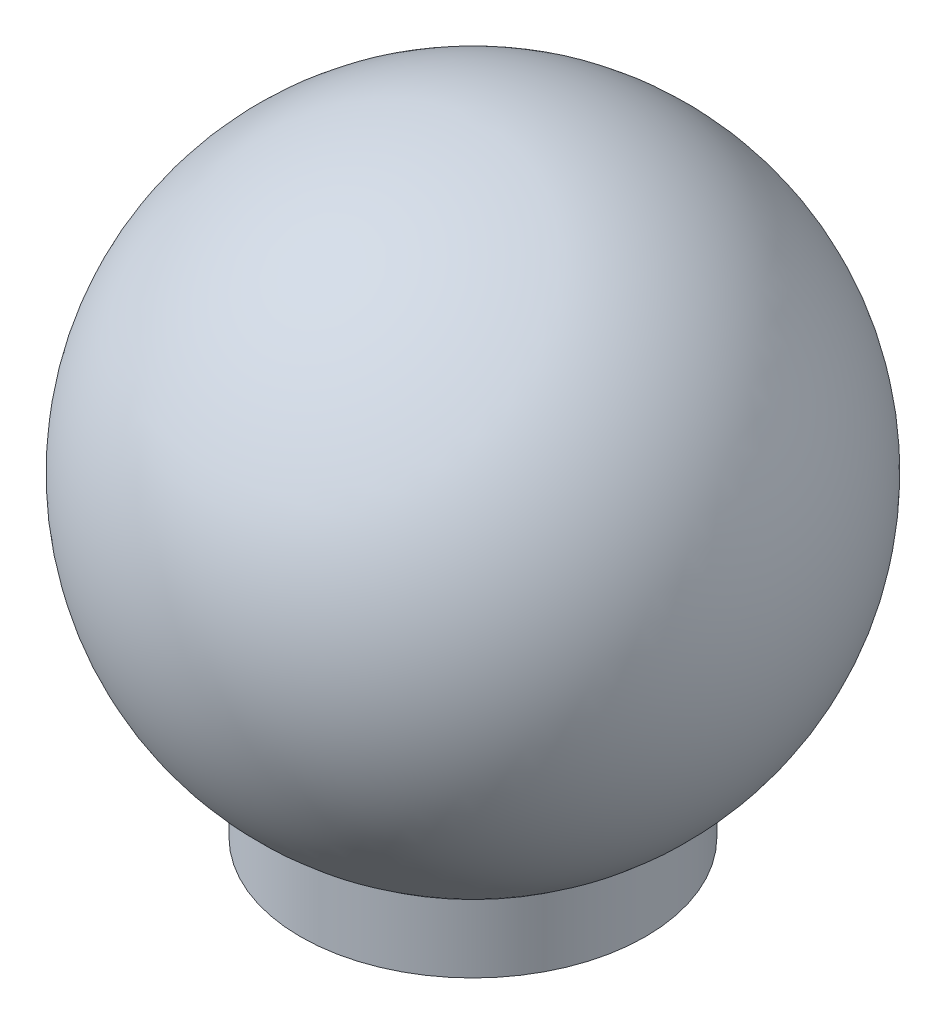
from build123d import *

# Parameters (mm, degrees)
SKETCH1_R           = 25.4
BOSS_EXTRUDE1_DEPTH = 10


with BuildPart() as part:
    # Sketch1 → Boss-Extrude1 (new body)
    with BuildSketch(Plane(origin=(0, 0, 0), x_dir=(1, 0, 0), z_dir=(0, 1, 0))):
        with Locations(Location((0, 0, 0), (0, 0, 270))):
            Circle(SKETCH1_R)
    extrude(amount=BOSS_EXTRUDE1_DEPTH)

    # Sketch2 one side → Revolve1 (revolve)
    with BuildSketch(Plane.XY):
        with BuildLine():
            Line((25.4, 10), (0, 10))
            Line((0, 10), (0, 2.027972806))
            ThreePointArc((0, 2.027972806), (13.310834098, 4.067783044), (25.4, 10))
        make_face()
        with BuildLine():
            ThreePointArc((44.45, 46.477972806), (31.430896424, 77.908869229), (0, 90.927972806))
            Line((0, 90.927972806), (0, 10))
            Line((0, 10), (25.4, 10))
            ThreePointArc((25.4, 10), (39.400713826, 25.901621088), (44.45, 46.477972806))
        make_face()
    revolve(axis=Axis((0, 145.460296173, 0), (0, -1, 0)))


solid = part.part
